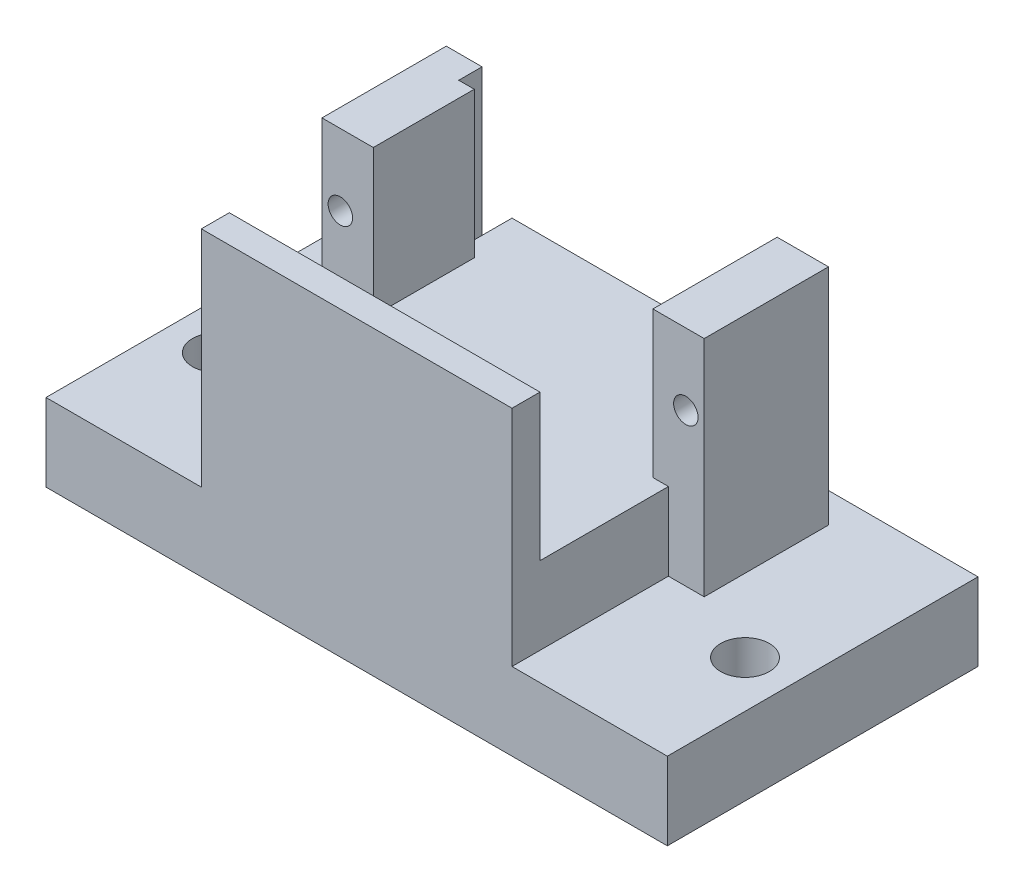
from build123d import *

# Parameters (mm, degrees)
SKETCH1_W           = 25.4
SKETCH1_H           = 25.4
BOSS_EXTRUDE1_DEPTH = 12.7
SKETCH2_W           = 25.4
SKETCH2_H           = 6.35
BOSS_EXTRUDE2_DEPTH = 12.7
SKETCH6_W           = 2.925
SKETCH6_H           = 10.16
BOSS_EXTRUDE3_DEPTH = 18.288
SKETCH8_W           = 1.27
SKETCH8_H           = 8.255
SKETCH8_H_2         = 10.16
BOSS_EXTRUDE4_DEPTH = 11.938
SKETCH9_W           = 25.4
SKETCH9_H           = 2.286
BOSS_EXTRUDE5_DEPTH = 11.938
SKETCH10_R          = 1.9939
CUT_EXTRUDE1_DEPTH  = 34.777225226
CUT_EXTRUDE2_DEPTH  = 43.17693142


with BuildPart() as part:
    # Sketch1 → Boss-Extrude1 (new body)
    with BuildSketch(Plane(origin=(0, 0, 0), x_dir=(1, 0, 0), z_dir=(0, 1, 0))):
        Rectangle(SKETCH1_W, SKETCH1_H)
    extrude(amount=BOSS_EXTRUDE1_DEPTH)

    # Sketch2 → Boss-Extrude2 (add)
    with BuildSketch(Plane.ZY.offset(12.7)):
        with Locations((0, 3.175)):
            Rectangle(SKETCH2_W, SKETCH2_H)
    boss_extrude2 = extrude(amount=BOSS_EXTRUDE2_DEPTH)

    # Mirror1: Boss-Extrude2 across plane
    add(boss_extrude2.mirror(Plane(origin=(0, 0, 0), x_dir=(0, 0, 1), z_dir=(1, 0, 0))))

    # Sketch6 → Boss-Extrude3 (add)
    with BuildSketch(Plane(origin=(0, 6.35, 0), x_dir=(1, 0, 0), z_dir=(0, 1, 0))):
        with Locations((-14.1625, 5.17)):
            Rectangle(SKETCH6_W, SKETCH6_H)
        with Locations((14.1625, 5.17)):
            Rectangle(SKETCH6_W, SKETCH6_H)
    extrude(amount=BOSS_EXTRUDE3_DEPTH)

    # Sketch8 → Boss-Extrude4 (add)
    with BuildSketch(Plane(origin=(0, 12.7, 0), x_dir=(1, 0, 0), z_dir=(0, 1, 0))):
        with Locations((-12.065, 4.2175)):
            Rectangle(SKETCH8_W, SKETCH8_H)
        with Locations((12.065, 5.17)):
            Rectangle(SKETCH8_W, SKETCH8_H_2)
    extrude(amount=BOSS_EXTRUDE4_DEPTH)

    # Sketch9 → Boss-Extrude5 (add)
    with BuildSketch(Plane(origin=(0, 12.7, 0), x_dir=(1, 0, 0), z_dir=(0, 1, 0))):
        with Locations((0, -11.557)):
            Rectangle(SKETCH9_W, SKETCH9_H)
    extrude(amount=BOSS_EXTRUDE5_DEPTH)

    # Sketch10 → Cut-Extrude1 (cut, through all)
    with BuildSketch(Plane(origin=(0, 6.35, 0), x_dir=(1, 0, 0), z_dir=(0, 1, 0))):
        with Locations(Location((21.59, -2.54, 0), (0, 0, 270))):
            Circle(SKETCH10_R)
        with Locations(Location((-21.59, -2.54, 0), (0, 0, 270))):
            Circle(SKETCH10_R)
    extrude(amount=-CUT_EXTRUDE1_DEPTH, mode=Mode.SUBTRACT)

    # Sketch11 → Cut-Extrude2 (cut, through all)
    with BuildSketch(Plane(origin=(0, 0, -10.25), x_dir=(-1, 0, 0), z_dir=(0, 0, -1))):
        with BuildLine():
            ThreePointArc((15.125, 18.8), (15.090925826, 19.058819045), (14.991025404, 19.3))
            ThreePointArc((14.991025404, 19.3), (13.125, 18.8), (14.991025404, 18.3))
            ThreePointArc((14.991025404, 18.3), (15.090925826, 18.541180955), (15.125, 18.8))
        make_face()
        with BuildLine():
            ThreePointArc((-14.991025404, 19.3), (-15.125, 18.8), (-14.991025404, 18.3))
            ThreePointArc((-14.991025404, 18.3), (-13.866180955, 17.834074174), (-13.125, 18.8))
            ThreePointArc((-13.125, 18.8), (-13.866180955, 19.765925826), (-14.991025404, 19.3))
        make_face()
    extrude(amount=-CUT_EXTRUDE2_DEPTH, mode=Mode.SUBTRACT)


solid = part.part
